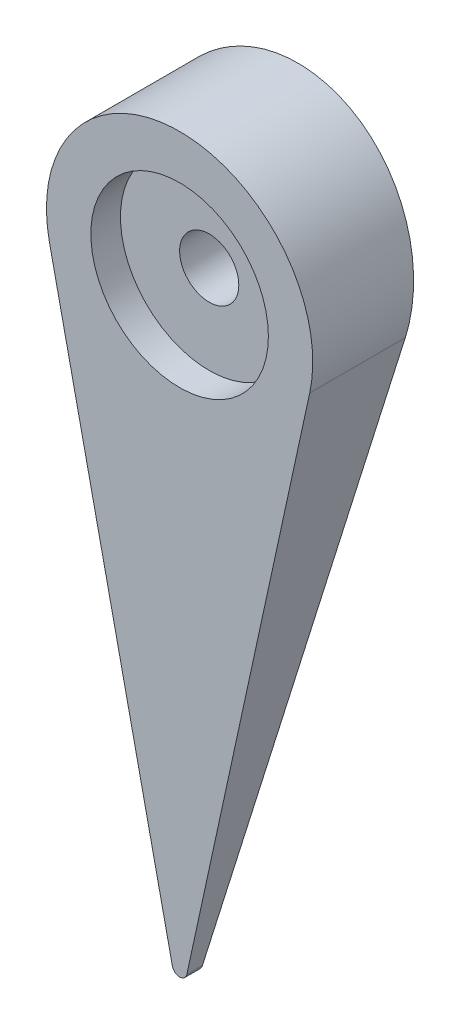
from build123d import *

# Parameters (mm, degrees)
ESBO_O1_R                  = 1
RESSALTO_EXTRUS_O1_DEPTH   = 5
CORTE_EXTRUS_O1_DEPTH      = 5
CORTE_EXTRUS_O1_DEPTH_BACK = 5
ESBO_O3_R                  = 3
CORTE_EXTRUS_O2_DEPTH      = 1


with BuildPart() as part:
    # Esboço1 → Ressalto-extrusão1 (new body)
    with BuildSketch(Plane.XY):
        with BuildLine():
            Line((4.3972248, -0.95625), (0.244290267, -20.053125))
            ThreePointArc((0.244290267, -20.053125), (0, -20.25), (-0.244290267, -20.053125))
            Line((-0.244290267, -20.053125), (-4.3972248, -0.95625))
            ThreePointArc((-4.3972248, -0.95625), (0, 4.5), (4.3972248, -0.95625))
        make_face()
        Circle(ESBO_O1_R, mode=Mode.SUBTRACT)
    extrude(amount=RESSALTO_EXTRUS_O1_DEPTH)

    # Esboço2 → Corte-extrusão1 (cut, two sides: drawn at the far end of the back side and taken through both)
    with BuildSketch(Plane(origin=(0, 0, 0), x_dir=(0, 0, -1), z_dir=(1, 0, 0)).offset(-CORTE_EXTRUS_O1_DEPTH_BACK)):
        Polygon((0, 4.5), (0, -20.25), (-4.5, -20.25), (-1, 4.5), align=None)
    extrude(amount=CORTE_EXTRUS_O1_DEPTH + CORTE_EXTRUS_O1_DEPTH_BACK, mode=Mode.SUBTRACT)

    # Esboço3 → Corte-extrusão2 (cut)
    with BuildSketch(Plane.XY.offset(5)):
        Circle(ESBO_O3_R)
    extrude(amount=-CORTE_EXTRUS_O2_DEPTH, mode=Mode.SUBTRACT)


solid = part.part
